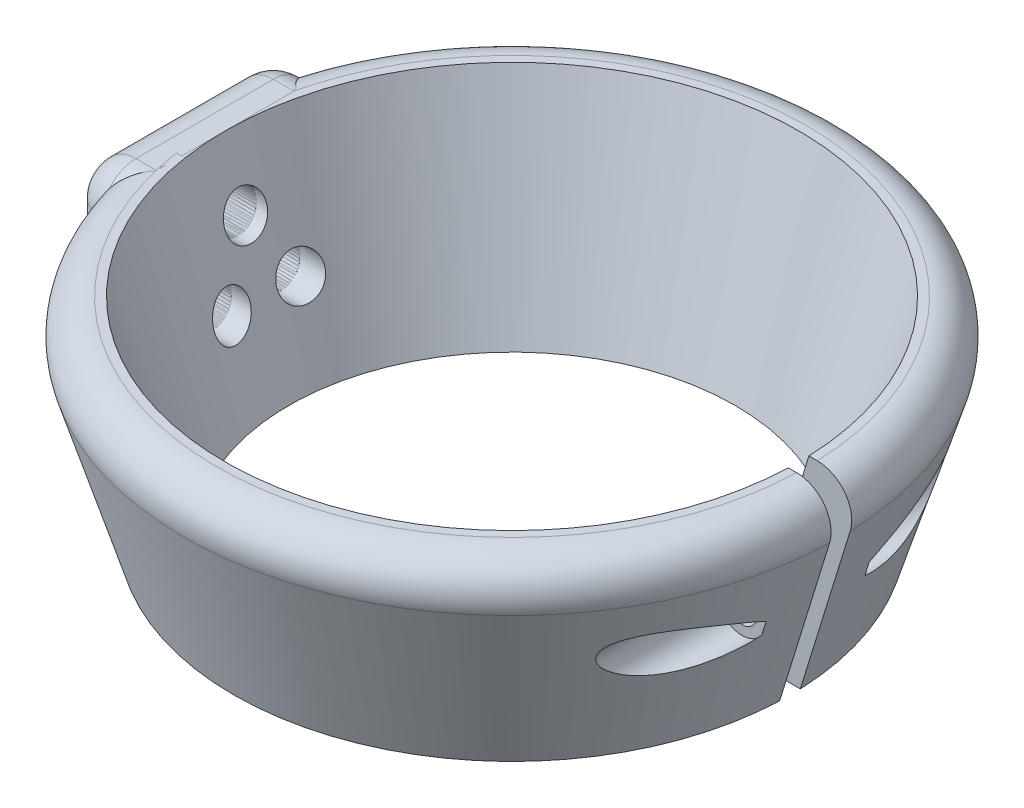
from build123d import *

# Parameters (mm, degrees)
SKETCH3_W           = 85.582193323
SKETCH3_H           = 3
CUT_EXTRUDE1_DEPTH  = 77.48610985
SKETCH4_R           = 1.65
CUT_EXTRUDE2_DEPTH  = 72.938341655
SKETCH6_R           = 3.5
CUT_EXTRUDE3_DEPTH  = 78.315102175
BOSS_EXTRUDE1_DEPTH = 15
SKETCH9_R           = 1.65
CUT_EXTRUDE5_DEPTH  = 30
SKETCH10_R          = 3.075
CUT_EXTRUDE6_DEPTH  = 46
FILLET2_R           = 5
FILLET3_R           = 5
SKETCH7_R           = 2.125
CUT_EXTRUDE8_DEPTH  = 72.749164005


with BuildPart() as part:
    # Sketch2 → Revolve1 (revolve)
    with BuildSketch(Plane(origin=(0, 0, 0), x_dir=(0, 0, -1), z_dir=(1, 0, 0)), mode=Mode.PRIVATE) as revolve1_sk:
        Polygon((-40.5, -15), (-49.75, 15), (-41.75, 15), (-32.5, -15), align=None)
    revolve(revolve1_sk.sketch.rotate(Axis((0, 0, 0), (0, 1, 0)), 180), axis=Axis((0, 0, 0), (0, 1, 0)))

    # Sketch3 → Cut-Extrude1 (cut, through all)
    with BuildSketch(Plane(origin=(0, 15, 0), x_dir=(1, 0, 0), z_dir=(0, 1, 0))):
        with Locations((70.867468383, 0)):
            Rectangle(SKETCH3_W, SKETCH3_H)
    extrude(amount=-CUT_EXTRUDE1_DEPTH, mode=Mode.SUBTRACT)

    # Sketch4 → Cut-Extrude2 (cut, through all)
    with BuildSketch(Plane.XY):
        with Locations(Location((41, 0, 0), (0, 0, 184.862847026))):
            Circle(SKETCH4_R)
    extrude(amount=-CUT_EXTRUDE2_DEPTH, mode=Mode.SUBTRACT)

    # Sketch6 → Cut-Extrude3 (cut, through all)
    with BuildSketch(Plane.XY.offset(-7.5)):
        with Locations((41, 0)):
            Circle(SKETCH6_R)
    cut_extrude3 = extrude(amount=-CUT_EXTRUDE3_DEPTH, mode=Mode.SUBTRACT)

    # Mirror1: Cut-Extrude3 across plane
    add(cut_extrude3.mirror(Plane.XY), mode=Mode.SUBTRACT)


with BuildPart() as body_2:
    # Sketch8 → Boss-Extrude1 (new, symmetric)
    with BuildSketch(Plane.XY):
        Polygon((-49.75, 15), (-49.75, -15), (-37.099538058, -15), (-41.75, 15), align=None)
    extrude(amount=BOSS_EXTRUDE1_DEPTH, both=True)


with BuildPart() as cut_extrude5_tool:
    # Sketch9 → Cut-Extrude5 (new body)
    with BuildSketch(Plane.ZY.offset(49.75)):
        with Locations(Location((0, 5.773502692, 0), (0, 0, 270))):
            Circle(SKETCH9_R)
        with Locations(Location((5, -2.886751346, 0), (0, 0, 270))):
            Circle(SKETCH9_R)
        with Locations(Location((-5, -2.886751346, 0), (0, 0, 270))):
            Circle(SKETCH9_R)
    extrude(amount=-CUT_EXTRUDE5_DEPTH)


with BuildPart() as part_1:
    add(part.part)

    # Cut-Extrude5: cut by cut_extrude5_tool
    add(cut_extrude5_tool.part, mode=Mode.SUBTRACT)


with BuildPart() as body_2_1:
    add(body_2.part)

    # Cut-Extrude5: cut by cut_extrude5_tool
    add(cut_extrude5_tool.part, mode=Mode.SUBTRACT)


with BuildPart() as cut_extrude6_tool:
    # Sketch10 → Cut-Extrude6 (new body)
    with BuildSketch(Plane(origin=(0, 0, 0), x_dir=(0, 0, -1), z_dir=(1, 0, 0))):
        with Locations((5, -2.886751346)):
            Circle(SKETCH10_R)
        with Locations((-5, -2.886751346)):
            Circle(SKETCH10_R)
        with Locations((0, 5.773502692)):
            Circle(SKETCH10_R)
    extrude(amount=-CUT_EXTRUDE6_DEPTH)


with BuildPart() as part_2:
    add(part_1.part)

    # Cut-Extrude6: cut by cut_extrude6_tool
    add(cut_extrude6_tool.part, mode=Mode.SUBTRACT)

    # Fillet3
    fillet3_edges = [part_2.edges().sort_by_distance(p)[0] for p in [
        (-49.75, 15, 0),
    ]]
    fillet(fillet3_edges, radius=FILLET3_R)

    # Sketch7 → Cut-Extrude8 (cut, through all)
    with BuildSketch(Plane(origin=(0, 0, 1.5), x_dir=(-1, 0, 0), z_dir=(0, 0, -1))):
        with Locations((-41, 0)):
            Circle(SKETCH7_R)
    extrude(amount=-CUT_EXTRUDE8_DEPTH, mode=Mode.SUBTRACT)


with BuildPart() as body_2_2:
    add(body_2_1.part)

    # Cut-Extrude6: cut by cut_extrude6_tool
    add(cut_extrude6_tool.part, mode=Mode.SUBTRACT)

    # Fillet2
    fillet2_edges = [body_2_2.edges().sort_by_distance(p)[0] for p in [
        (-45.75, 15, 15),
        (-49.75, 0, -15),
        (-45.75, 15, -15),
        (-49.75, 15, 0),
        (-49.75, 0, 15),
    ]]
    fillet(fillet2_edges, radius=FILLET2_R)


solid = Compound([part_2.part, body_2_2.part])
